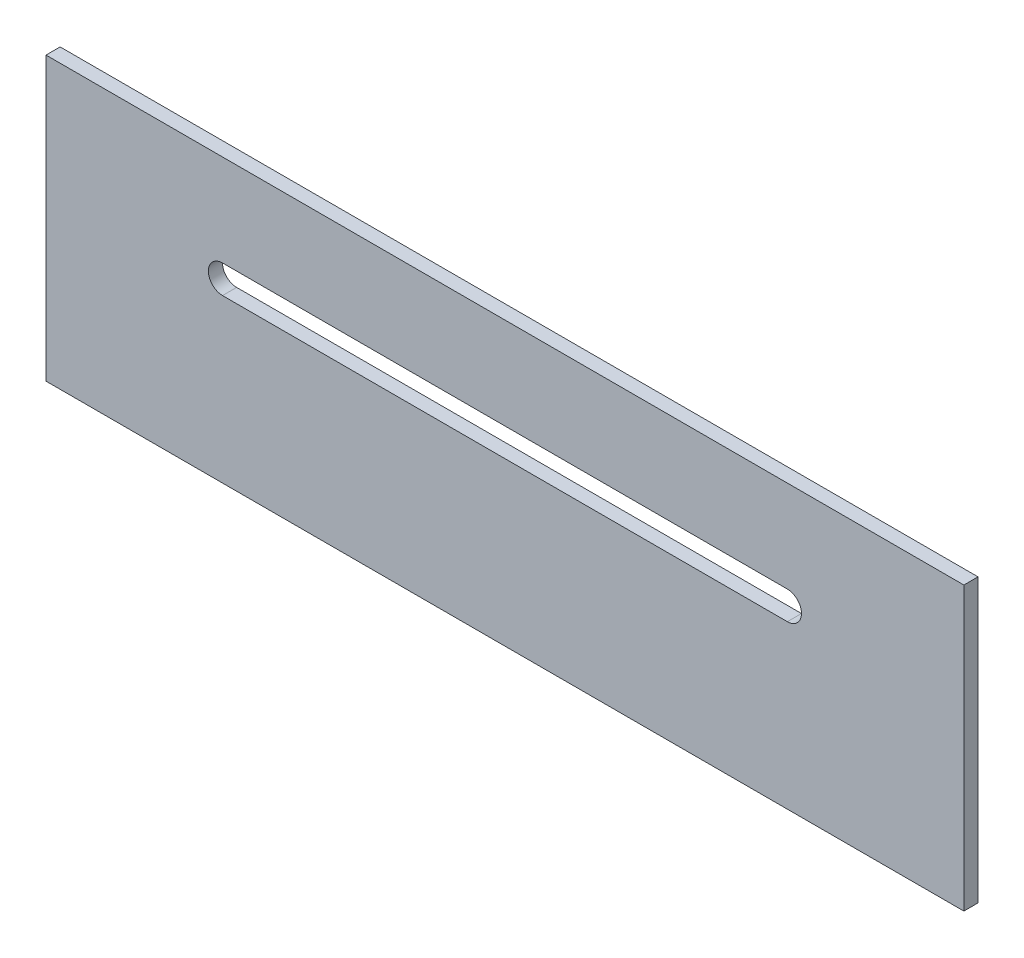
from build123d import *

# Parameters (mm, degrees)
SKETCH1_W           = 130
SKETCH1_H           = 40
BOSS_EXTRUDE1_DEPTH = 2
CUT_EXTRUDE1_DEPTH  = 69.036754773


with BuildPart() as part:
    # Sketch1 → Boss-Extrude1 (new body)
    with BuildSketch(Plane.XY):
        Rectangle(SKETCH1_W, SKETCH1_H)
    extrude(amount=BOSS_EXTRUDE1_DEPTH)

    # Sketch2 → Cut-Extrude1 (cut, through all)
    with BuildSketch(Plane.XY.offset(2)):
        with BuildLine():
            Line((-40, 7), (40, 7))
            ThreePointArc((40, 7), (42, 5), (40, 3))
            Line((40, 3), (-40, 3))
            ThreePointArc((-40, 3), (-42, 5), (-40, 7))
        make_face()
    extrude(amount=-CUT_EXTRUDE1_DEPTH, mode=Mode.SUBTRACT)


solid = part.part
